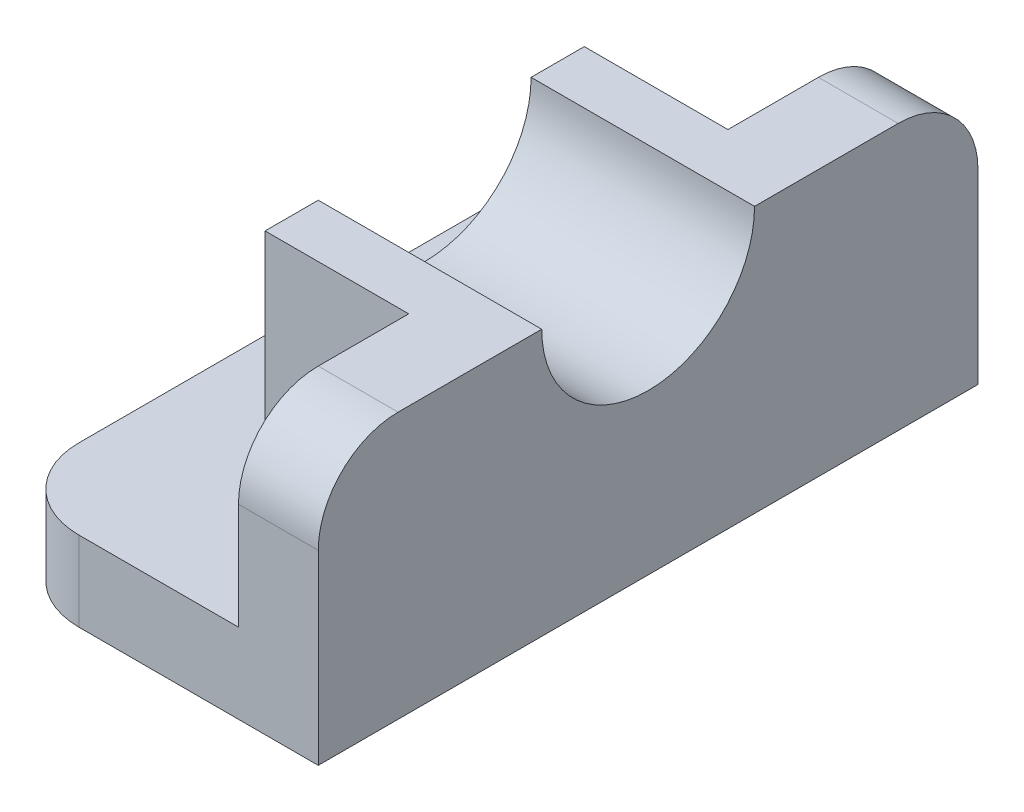
from build123d import *

# Parameters (mm, degrees)
BOSS_EXTRUDE1_DEPTH = 124
FILLET1_R           = 15
SKETCH4_W           = 60
SKETCH4_H           = 35
BOSS_EXTRUDE2_DEPTH = 27
SKETCH5_R           = 20
CUT_EXTRUDE1_DEPTH  = 61


with BuildPart() as part:
    # Sketch2 → Boss-Extrude1 (new body)
    with BuildSketch(Plane.XY):
        Polygon((0, 0), (60, 0), (60, 50), (45, 50), (45, 15), (0, 15), align=None)
    extrude(amount=BOSS_EXTRUDE1_DEPTH)

    # Fillet1
    fillet1_edges = [part.edges().sort_by_distance(p)[0] for p in [
        (52.5, 50, 124),
        (0, 7.5, 124),
        (52.5, 50, 0),
        (0, 7.5, 0),
    ]]
    fillet(fillet1_edges, radius=FILLET1_R)

    # Sketch4 → Boss-Extrude2 (add)
    with BuildSketch(Plane.ZY.offset(-45)):
        with Locations((62, 32.5)):
            Rectangle(SKETCH4_W, SKETCH4_H)
    extrude(amount=BOSS_EXTRUDE2_DEPTH)

    # Sketch5 → Cut-Extrude1 (cut)
    with BuildSketch(Plane.ZY.offset(-18)):
        with Locations((62, 50)):
            Circle(SKETCH5_R)
    extrude(amount=-CUT_EXTRUDE1_DEPTH, mode=Mode.SUBTRACT)


solid = part.part
